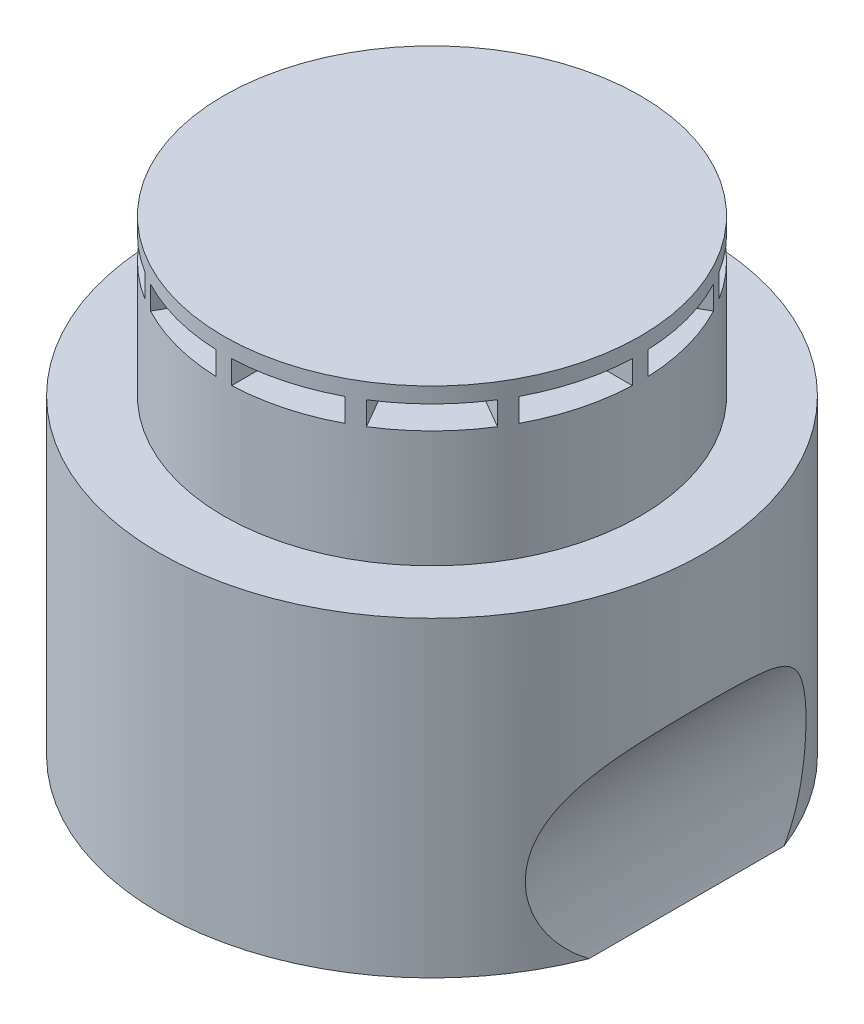
from build123d import *

# Parameters (mm, degrees)
SKETCH_1_R               = 70
EXTRUDE_1_DEPTH          = 80
SKETCH_2_R               = 53.5
EXTRUDE_2_DEPTH          = 40
CUT_EXTRUDE_1_DEPTH      = 6
SKETCH_4_R               = 40
CUT_EXTRUDE_2_DEPTH      = 156.563491861
CUT_EXTRUDE_3_DEPTH      = 30
CUT_EXTRUDE_3_DEPTH_BACK = 156.563491951
SKETCH_5_W               = 84
SKETCH_5_H               = 120


with BuildPart() as part:
    # 草图1 → 凸台-拉伸1 (new body)
    with BuildSketch(Plane(origin=(0, 0, 0), x_dir=(1, 0, 0), z_dir=(0, 1, 0))):
        with Locations(Location((0, 0, 0), (0, 0, 270))):
            Circle(SKETCH_1_R)
    extrude(amount=EXTRUDE_1_DEPTH)

    # 草图2 → 凸台-拉伸2 (add)
    with BuildSketch(Plane(origin=(0, 80, 0), x_dir=(1, 0, 0), z_dir=(0, 1, 0))):
        with Locations(Location((0, 0, 0), (0, 0, 270))):
            Circle(SKETCH_2_R)
    extrude(amount=EXTRUDE_2_DEPTH)

    # 草图3 → 切除-拉伸1 (cut)
    with BuildSketch(Plane(origin=(0, 110, 0), x_dir=(1, 0, 0), z_dir=(0, 1, 0))):
        with BuildLine():
            ThreePointArc((-35.597687784, -18.242933548), (-38.637033052, -10.352761804), (-39.949968711, -2))
            Line((-39.949968711, -2), (-53.462603753, -2))
            ThreePointArc((-53.462603753, -2), (-51.677031706, -13.846818913), (-47.299973002, -24.999251069))
            Line((-47.299973002, -24.999251069), (-35.597687784, -18.242933548))
        make_face()
        with BuildLine():
            ThreePointArc((-39.949968711, 2), (-38.637033052, 10.352761804), (-35.597687784, 18.242933548))
            Line((-35.597687784, 18.242933548), (-47.299973002, 24.999251069))
            ThreePointArc((-47.299973002, 24.999251069), (-51.677031706, 13.846818913), (-53.462603753, 2))
            Line((-53.462603753, 2), (-39.949968711, 2))
        make_face()
        with BuildLine():
            ThreePointArc((-33.597687784, 21.707035163), (-28.284271247, 28.284271247), (-21.707035163, 33.597687784))
            Line((-21.707035163, 33.597687784), (-28.463352684, 45.299973002))
            ThreePointArc((-28.463352684, 45.299973002), (-37.830212793, 37.830212793), (-45.299973002, 28.463352684))
            Line((-45.299973002, 28.463352684), (-33.597687784, 21.707035163))
        make_face()
        with BuildLine():
            ThreePointArc((-18.242933548, 35.597687784), (-10.352761804, 38.637033052), (-2, 39.949968711))
            Line((-2, 39.949968711), (-2, 53.462603753))
            ThreePointArc((-2, 53.462603753), (-13.846818913, 51.677031706), (-24.999251069, 47.299973002))
            Line((-24.999251069, 47.299973002), (-18.242933548, 35.597687784))
        make_face()
        with BuildLine():
            Line((2, 53.462603753), (2, 39.949968711))
            ThreePointArc((2, 39.949968711), (10.352761804, 38.637033052), (18.242933548, 35.597687784))
            Line((18.242933548, 35.597687784), (24.999251069, 47.299973002))
            ThreePointArc((24.999251069, 47.299973002), (13.846818913, 51.677031706), (2, 53.462603753))
        make_face()
        with BuildLine():
            Line((28.463352684, 45.299973002), (21.707035163, 33.597687784))
            ThreePointArc((21.707035163, 33.597687784), (28.284271247, 28.284271247), (33.597687784, 21.707035163))
            Line((33.597687784, 21.707035163), (45.299973002, 28.463352684))
            ThreePointArc((45.299973002, 28.463352684), (37.830212793, 37.830212793), (28.463352684, 45.299973002))
        make_face()
        with BuildLine():
            Line((47.299973002, 24.999251069), (35.597687784, 18.242933548))
            ThreePointArc((35.597687784, 18.242933548), (38.637033052, 10.352761804), (39.949968711, 2))
            Line((39.949968711, 2), (53.462603753, 2))
            ThreePointArc((53.462603753, 2), (51.677031706, 13.846818913), (47.299973002, 24.999251069))
        make_face()
        with BuildLine():
            Line((53.462603753, -2), (39.949968711, -2))
            ThreePointArc((39.949968711, -2), (38.637033052, -10.352761804), (35.597687784, -18.242933548))
            Line((35.597687784, -18.242933548), (47.299973002, -24.999251069))
            ThreePointArc((47.299973002, -24.999251069), (51.677031706, -13.846818913), (53.462603753, -2))
        make_face()
        with BuildLine():
            Line((45.299973002, -28.463352684), (33.597687784, -21.707035163))
            ThreePointArc((33.597687784, -21.707035163), (28.284271247, -28.284271247), (21.707035163, -33.597687784))
            Line((21.707035163, -33.597687784), (28.463352684, -45.299973002))
            ThreePointArc((28.463352684, -45.299973002), (37.830212793, -37.830212793), (45.299973002, -28.463352684))
        make_face()
        with BuildLine():
            Line((24.999251069, -47.299973002), (18.242933548, -35.597687784))
            ThreePointArc((18.242933548, -35.597687784), (10.352761804, -38.637033052), (2, -39.949968711))
            Line((2, -39.949968711), (2, -53.462603753))
            ThreePointArc((2, -53.462603753), (13.846818913, -51.677031706), (24.999251069, -47.299973002))
        make_face()
        with BuildLine():
            ThreePointArc((-2, -39.949968711), (-10.352761804, -38.637033052), (-18.242933548, -35.597687784))
            Line((-18.242933548, -35.597687784), (-24.999251069, -47.299973002))
            ThreePointArc((-24.999251069, -47.299973002), (-13.846818913, -51.677031706), (-2, -53.462603753))
            Line((-2, -53.462603753), (-2, -39.949968711))
        make_face()
        with BuildLine():
            ThreePointArc((-21.707035163, -33.597687784), (-28.284271247, -28.284271247), (-33.597687784, -21.707035163))
            Line((-33.597687784, -21.707035163), (-45.299973002, -28.463352684))
            ThreePointArc((-45.299973002, -28.463352684), (-37.830212793, -37.830212793), (-28.463352684, -45.299973002))
            Line((-28.463352684, -45.299973002), (-21.707035163, -33.597687784))
        make_face()
    extrude(amount=CUT_EXTRUDE_1_DEPTH, mode=Mode.SUBTRACT)

    # 草图4 → 切除-拉伸2 (cut, symmetric)
    with BuildSketch(Plane.XY):
        with Locations((100, 20)):
            Circle(SKETCH_4_R)
    cut_extrude_2 = extrude(amount=CUT_EXTRUDE_2_DEPTH, both=True, mode=Mode.SUBTRACT)

    # 镜向1: 切除-拉伸2 across plane
    add(cut_extrude_2.mirror(Plane(origin=(0, 0, 0), x_dir=(0, 0, 1), z_dir=(1, 0, 0))), mode=Mode.SUBTRACT)

    # 草图5 → 切除-拉伸3 (cut, two sides: drawn at the far end of the back side and taken through both)
    with BuildSketch(Plane.XY.offset(-CUT_EXTRUDE_3_DEPTH_BACK)):
        Rectangle(SKETCH_5_W, SKETCH_5_H)
    extrude(amount=CUT_EXTRUDE_3_DEPTH + CUT_EXTRUDE_3_DEPTH_BACK, mode=Mode.SUBTRACT)


solid = part.part
